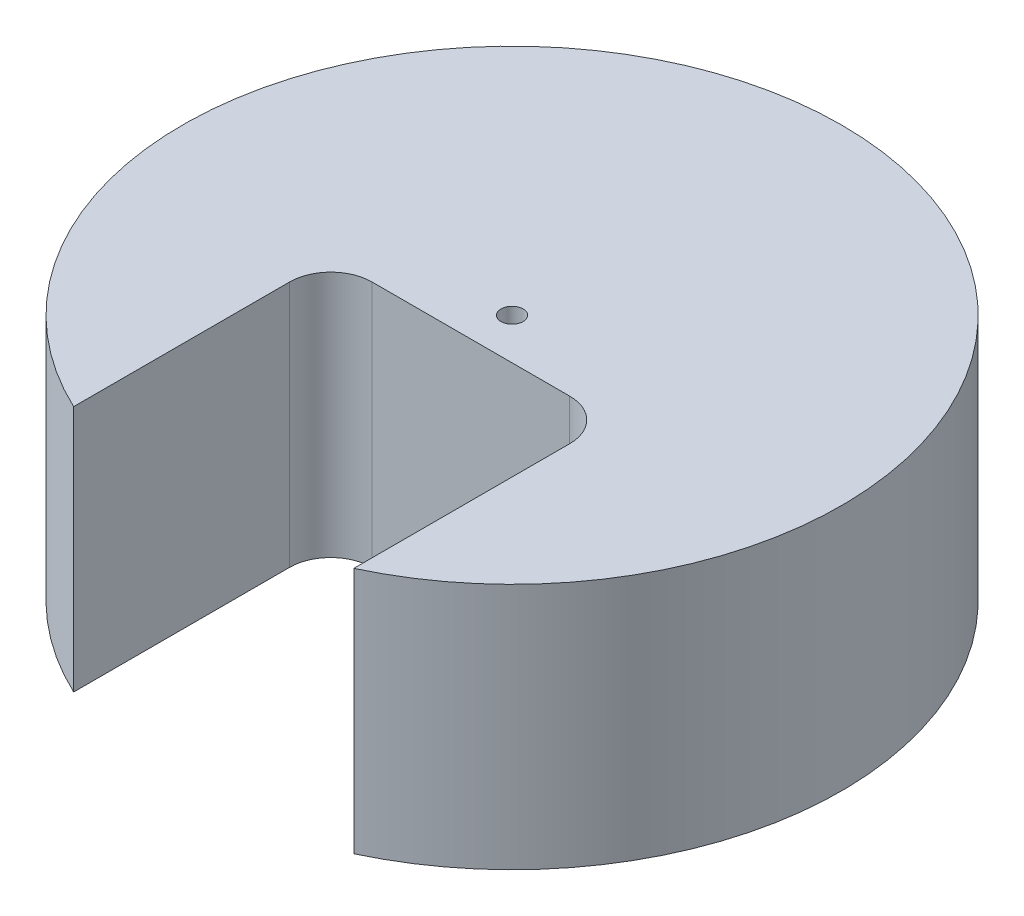
from build123d import *

# Parameters (mm, degrees)
SKETCH1_R            = 50.8
BOSS_EXTRUDE1_DEPTH  = 38.1
CUT_EXTRUDE1_REACH   = 83.32
SKETCH2_W            = 43.18
SKETCH2_H            = 44.45
FILLET1_R            = 6.35
M3_CLEARANCE_HOLE1_D = 3.4


with BuildPart() as part:
    # Sketch1 → Boss-Extrude1 (new body)
    with BuildSketch(Plane(origin=(0, 0, 0), x_dir=(1, 0, 0), z_dir=(0, 1, 0))):
        with Locations(Location((0, 0, 0), (0, 0, 90))):
            Circle(SKETCH1_R)
    extrude(amount=BOSS_EXTRUDE1_DEPTH)

    # Sketch2 → Cut-Extrude1 (cut, up to next)
    with BuildSketch(Plane(origin=(0, 38.1, 0), x_dir=(1, 0, 0), z_dir=(0, 1, 0)), mode=Mode.PRIVATE) as cut_extrude1_sk1:
        with Locations((0, -28.575)):
            Rectangle(SKETCH2_W, SKETCH2_H)
    cut_extrude1_tool1 = extrude(cut_extrude1_sk1.sketch, amount=-CUT_EXTRUDE1_REACH, mode=Mode.PRIVATE) & part.part
    add(cut_extrude1_tool1.solids().sort_by_distance((0, 38.1, 28.575))[0], mode=Mode.SUBTRACT)

    # Fillet1
    fillet1_edges = [part.edges().sort_by_distance(p)[0] for p in [
        (-21.59, 19.05, 6.35),
        (21.59, 19.05, 6.35),
    ]]
    fillet(fillet1_edges, radius=FILLET1_R)

    # M3 Clearance Hole1 (through all)
    with Locations(Plane(origin=(0, 38.1, 0), x_dir=(1, 0, 0), z_dir=(0, 1, 0))):
        with Locations((0, 0)):
            Hole(M3_CLEARANCE_HOLE1_D / 2)


solid = part.part
